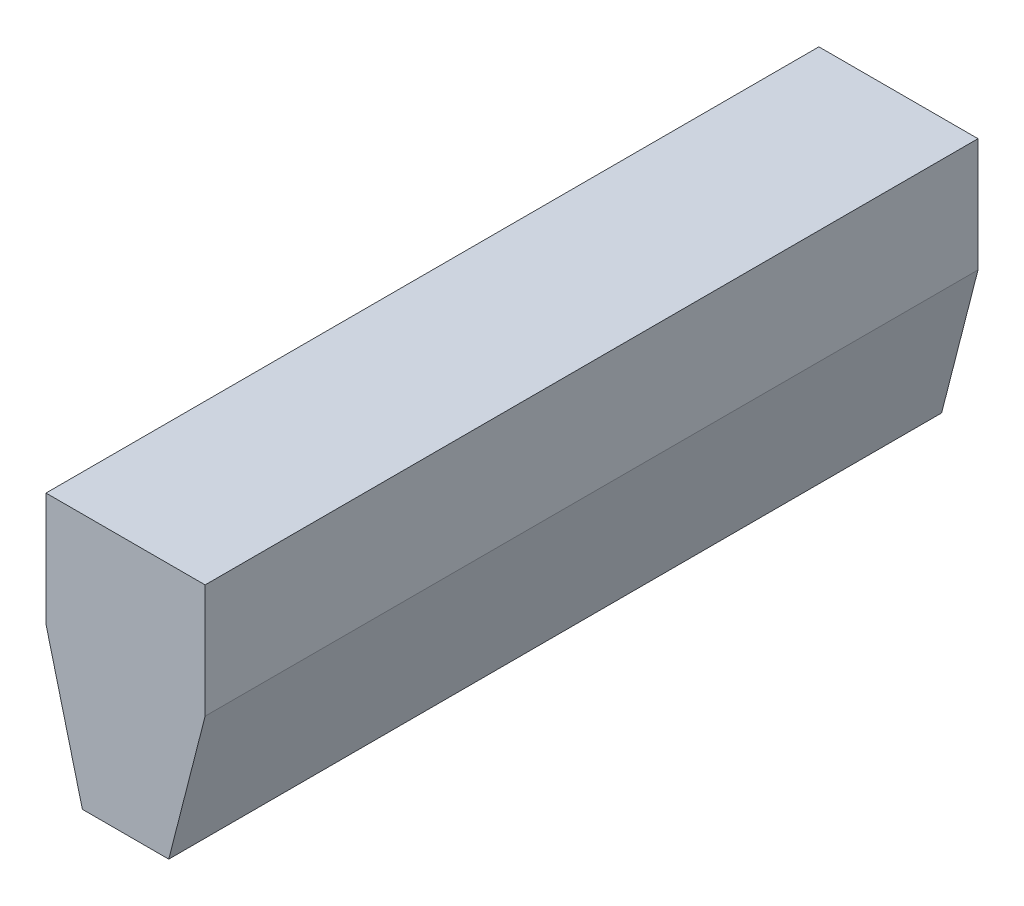
from build123d import *

# Parameters (mm, degrees)
KAPYAG_PC_GOVDE_5MM_1_START = -20
KAPYAG_PC_GOVDE_5MM_1_DEPTH = 680


with BuildPart() as part:
    # Sketch1 → KAPYAG_PC_govde_5mm_1 (new body)
    with BuildSketch(Plane.XY.offset(KAPYAG_PC_GOVDE_5MM_1_START)):
        Polygon((-70, 255), (70, 255), (70, 155), (38, 30), (-38, 30), (-70, 155), align=None)
    extrude(amount=-KAPYAG_PC_GOVDE_5MM_1_DEPTH)


solid = part.part
